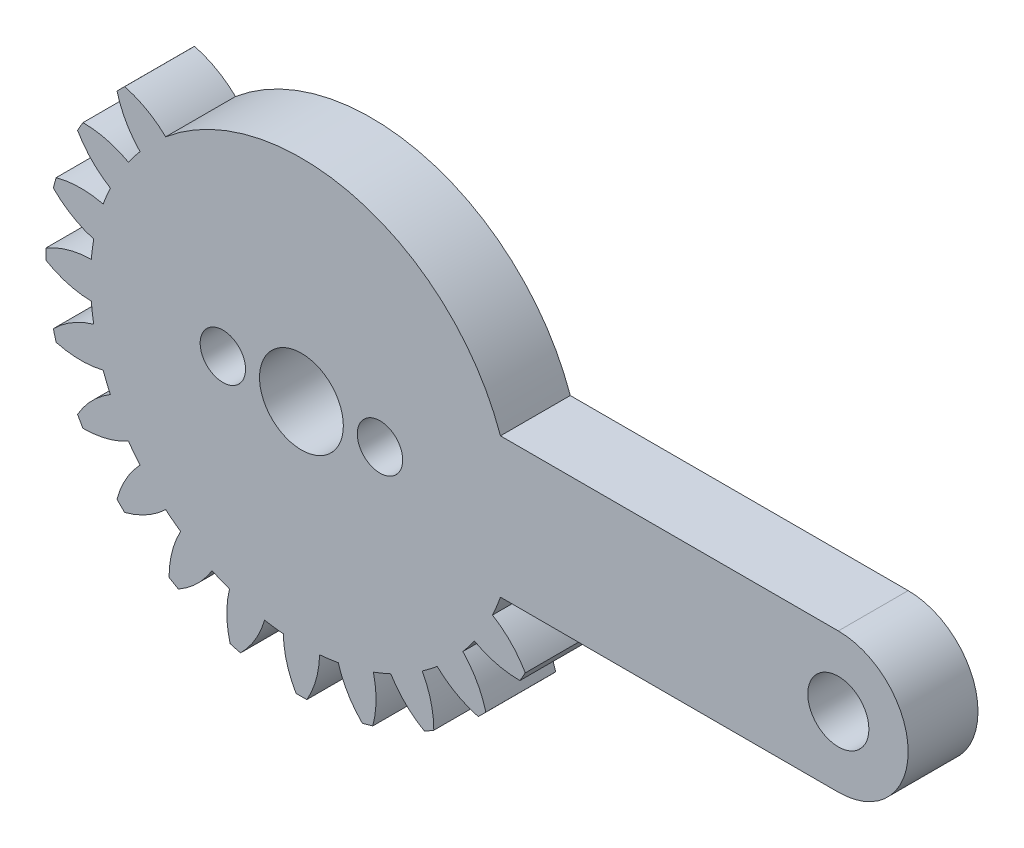
from build123d import *

# Parameters (mm, degrees)
SKETCH1_R           = 1.75
BOSS_EXTRUDE3_DEPTH = 4
SKETCH3_R           = 1.3
SKETCH3_R_2         = 2.4
CUT_EXTRUDE1_DEPTH  = 38.915688046


with BuildPart() as part:
    # Sketch1 → Boss-Extrude3 (new body)
    with BuildSketch(Plane.XY):
        with BuildLine():
            ThreePointArc((11.398526221, 4), (3.187763399, 11.651805204), (-7.774744082, 9.245526186))
            ThreePointArc((-7.774744082, 9.245526186), (-8.865739978, 10.052419077), (-10.123446462, 10.561852666))
            ThreePointArc((-10.123446462, 10.561852666), (-10.344972209, 10.344972209), (-10.561852666, 10.123446462))
            ThreePointArc((-10.561852666, 10.123446462), (-10.052419077, 8.865739978), (-9.245526186, 7.774744082))
            ThreePointArc((-9.245526186, 7.774744082), (-9.583708351, 7.353838062), (-9.90274436, 6.918240682))
            ThreePointArc((-9.90274436, 6.918240682), (-11.16540472, 7.415268848), (-12.51210701, 7.581825517))
            ThreePointArc((-12.51210701, 7.581825517), (-12.669951657, 7.315), (-12.82210701, 7.044889767))
            ThreePointArc((-12.82210701, 7.044889767), (-12.004513558, 5.961889707), (-10.94274436, 5.116907842))
            ThreePointArc((-10.94274436, 5.116907842), (-11.160464753, 4.622815863), (-11.355888976, 4.119488508))
            ThreePointArc((-11.355888976, 4.119488508), (-12.704165582, 4.272780301), (-14.048088143, 4.085109489))
            ThreePointArc((-14.048088143, 4.085109489), (-14.131494839, 3.78652263), (-14.208555951, 3.486235477))
            ThreePointArc((-14.208555951, 3.486235477), (-13.138520279, 2.651746506), (-11.89423259, 2.110362789))
            ThreePointArc((-11.89423259, 2.110362789), (-11.976653925, 1.576756402), (-12.035148524, 1.04))
            ThreePointArc((-12.035148524, 1.04), (-13.377158555, 0.839108838), (-14.626715284, 0.31))
            ThreePointArc((-14.626715284, 0.31), (-14.63, 0), (-14.626715284, -0.31))
            ThreePointArc((-14.626715284, -0.31), (-13.377158555, -0.839108838), (-12.035148524, -1.04))
            ThreePointArc((-12.035148524, -1.04), (-11.976653925, -1.576756402), (-11.89423259, -2.110362789))
            ThreePointArc((-11.89423259, -2.110362789), (-13.138520279, -2.651746506), (-14.208555951, -3.486235477))
            ThreePointArc((-14.208555951, -3.486235477), (-14.131494839, -3.78652263), (-14.048088143, -4.085109489))
            ThreePointArc((-14.048088143, -4.085109489), (-12.704165582, -4.272780301), (-11.355888976, -4.119488508))
            ThreePointArc((-11.355888976, -4.119488508), (-11.160464753, -4.622815863), (-10.94274436, -5.116907842))
            ThreePointArc((-10.94274436, -5.116907842), (-12.004513558, -5.961889707), (-12.82210701, -7.044889767))
            ThreePointArc((-12.82210701, -7.044889767), (-12.669951657, -7.315), (-12.51210701, -7.581825517))
            ThreePointArc((-12.51210701, -7.581825517), (-11.16540472, -7.415268848), (-9.90274436, -6.918240682))
            ThreePointArc((-9.90274436, -6.918240682), (-9.583708351, -7.353838062), (-9.245526186, -7.774744082))
            ThreePointArc((-9.245526186, -7.774744082), (-10.052419077, -8.865739978), (-10.561852666, -10.123446462))
            ThreePointArc((-10.561852666, -10.123446462), (-10.344972209, -10.344972209), (-10.123446462, -10.561852666))
            ThreePointArc((-10.123446462, -10.561852666), (-8.865739978, -10.052419077), (-7.774744082, -9.245526186))
            ThreePointArc((-7.774744082, -9.245526186), (-7.353838062, -9.583708351), (-6.918240682, -9.90274436))
            ThreePointArc((-6.918240682, -9.90274436), (-7.415268848, -11.16540472), (-7.581825517, -12.51210701))
            ThreePointArc((-7.581825517, -12.51210701), (-7.315, -12.669951657), (-7.044889767, -12.82210701))
            ThreePointArc((-7.044889767, -12.82210701), (-5.961889707, -12.004513558), (-5.116907842, -10.94274436))
            ThreePointArc((-5.116907842, -10.94274436), (-4.622815863, -11.160464753), (-4.119488508, -11.355888976))
            ThreePointArc((-4.119488508, -11.355888976), (-4.272780301, -12.704165582), (-4.085109489, -14.048088143))
            ThreePointArc((-4.085109489, -14.048088143), (-3.78652263, -14.131494839), (-3.486235477, -14.208555951))
            ThreePointArc((-3.486235477, -14.208555951), (-2.651746506, -13.138520279), (-2.110362789, -11.89423259))
            ThreePointArc((-2.110362789, -11.89423259), (-1.576756402, -11.976653925), (-1.04, -12.035148524))
            ThreePointArc((-1.04, -12.035148524), (-0.839108838, -13.377158555), (-0.31, -14.626715284))
            ThreePointArc((-0.31, -14.626715284), (0, -14.63), (0.31, -14.626715284))
            ThreePointArc((0.31, -14.626715284), (0.839108838, -13.377158555), (1.04, -12.035148524))
            ThreePointArc((1.04, -12.035148524), (1.576756402, -11.976653925), (2.110362789, -11.89423259))
            ThreePointArc((2.110362789, -11.89423259), (2.651746506, -13.138520279), (3.486235477, -14.208555951))
            ThreePointArc((3.486235477, -14.208555951), (3.78652263, -14.131494839), (4.085109489, -14.048088143))
            ThreePointArc((4.085109489, -14.048088143), (4.272780301, -12.704165582), (4.119488508, -11.355888976))
            ThreePointArc((4.119488508, -11.355888976), (4.622815863, -11.160464753), (5.116907842, -10.94274436))
            ThreePointArc((5.116907842, -10.94274436), (5.961889707, -12.004513558), (7.044889767, -12.82210701))
            ThreePointArc((7.044889767, -12.82210701), (7.315, -12.669951657), (7.581825517, -12.51210701))
            ThreePointArc((7.581825517, -12.51210701), (7.415268848, -11.16540472), (6.918240682, -9.90274436))
            ThreePointArc((6.918240682, -9.90274436), (7.353838062, -9.583708351), (7.774744082, -9.245526186))
            ThreePointArc((7.774744082, -9.245526186), (8.865739978, -10.052419077), (10.123446462, -10.561852666))
            ThreePointArc((10.123446462, -10.561852666), (10.344972209, -10.344972209), (10.561852666, -10.123446462))
            ThreePointArc((10.561852666, -10.123446462), (10.052419077, -8.865739978), (9.245526186, -7.774744082))
            ThreePointArc((9.245526186, -7.774744082), (9.583708351, -7.353838062), (9.90274436, -6.918240682))
            ThreePointArc((9.90274436, -6.918240682), (11.16540472, -7.415268848), (12.51210701, -7.581825517))
            ThreePointArc((12.51210701, -7.581825517), (12.669951657, -7.315), (12.82210701, -7.044889767))
            ThreePointArc((12.82210701, -7.044889767), (12.004513558, -5.961889707), (10.94274436, -5.116907842))
            ThreePointArc((10.94274436, -5.116907842), (11.184585981, -4.564146845), (11.398526221, -4))
            Line((11.398526221, -4), (30.75, -4))
            ThreePointArc((30.75, -4), (34.75, 0), (30.75, 4))
            Line((30.75, 4), (11.398526221, 4))
        make_face()
        Circle(SKETCH1_R, mode=Mode.SUBTRACT)
        with Locations((30.75, 0)):
            Circle(SKETCH1_R, mode=Mode.SUBTRACT)
    extrude(amount=BOSS_EXTRUDE3_DEPTH)

    # Sketch3 → Cut-Extrude1 (cut, through all)
    with BuildSketch(Plane.XY.offset(4)):
        with Locations((4.5, 0)):
            Circle(SKETCH3_R)
        with Locations((-4.5, 0)):
            Circle(SKETCH3_R)
        Circle(SKETCH3_R_2)
    extrude(amount=-CUT_EXTRUDE1_DEPTH, mode=Mode.SUBTRACT)


solid = part.part
